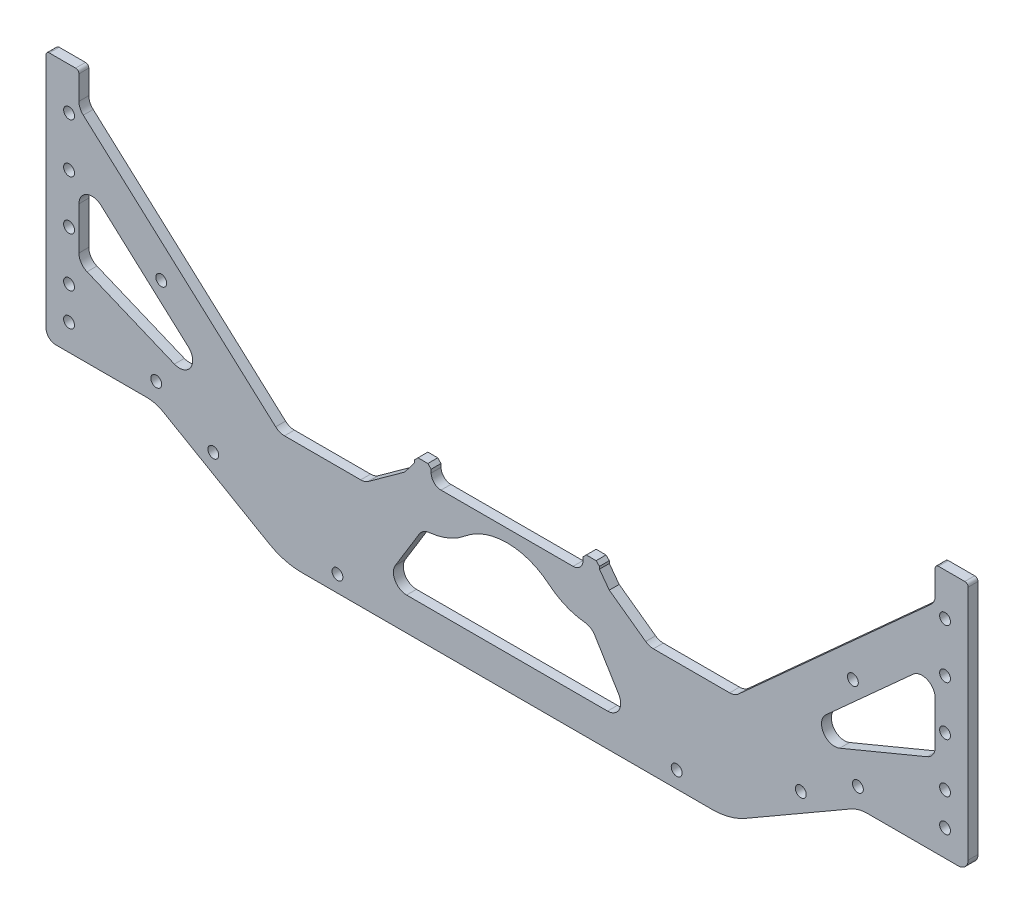
from build123d import *

# Parameters (mm, degrees)
SKETCH_1_R           = 1.65
EXTRUDE_1_DEPTH      = 3
FILLET_1_R           = 20
SKETCH_2_R           = 1.65
CUT_EXTRUDE_1_DEPTH  = 10
EXTRUDE_2_DEPTH      = 3
FILLET_2_R           = 10
EXTRUDE_3_DEPTH      = 3
FILLET_3_R           = 10
FILLET_4_R           = 3
SKETCH_6_R           = 1.65
CUT_EXTRUDE_2_DEPTH  = 5
EXTRUDE_4_DEPTH      = 3
SKETCH_8_R           = 1.65
CUT_EXTRUDE_3_DEPTH  = 10
EXTRUDE_5_DEPTH      = 3
FILLET_5_R           = 3
EXTRUDE_6_DEPTH      = 3
FILLET_6_R           = 2
SKETCH_11_W          = 10
SKETCH_11_H          = 67.386751346
EXTRUDE_7_DEPTH      = 3
SKETCH_14_W          = 280
SKETCH_14_H          = 9.594497852
CUT_EXTRUDE_6_DEPTH  = 30
CUT_EXTRUDE_7_DEPTH  = 10
SKETCH_16_W          = 82.254624056
SKETCH_16_H          = 6
EXTRUDE_8_DEPTH      = 3
CUT_EXTRUDE_9_DEPTH  = 30
FILLET_9_R           = 20
EXTRUDE_10_DEPTH     = 3
CUT_EXTRUDE_10_DEPTH = 10
FILLET_11_R          = 20
CUT_EXTRUDE_11_DEPTH = 10
EXTRUDE_11_DEPTH     = 3
SKETCH_23_W          = 21.095443302
SKETCH_23_H          = 17.701178694
CUT_EXTRUDE_12_DEPTH = 10
SKETCH_24_W          = 16.070083248
SKETCH_24_H          = 4.940251746
SKETCH_24_W_2        = 30.683823142
SKETCH_24_H_2        = 7.471575689
CUT_EXTRUDE_13_DEPTH = 10
EXTRUDE_12_DEPTH     = 3
CHAMFER_1_SIZE       = 10
EXTRUDE_13_DEPTH     = 3
EXTRUDE_14_DEPTH     = 3
FILLET_12_R          = 4
SKETCH_28_R          = 1.65
CUT_EXTRUDE_14_DEPTH = 10
SKETCH_29_W          = 366.05251881
SKETCH_29_H          = 37.988622271
CUT_EXTRUDE_15_DEPTH = 10
FILLET_13_R          = 1
SKETCH_30_W          = 8.246482756
SKETCH_30_H          = 14.254634478
SKETCH_30_W_2        = 7.090703909
SKETCH_30_H_2        = 16.159554859
EXTRUDE_15_DEPTH     = 3
SKETCH_31_R          = 1.65
EXTRUDE_16_DEPTH     = 3
EXTRUDE_17_DEPTH     = 3
FILLET_14_R          = 3
CHAMFER_2_SIZE       = 1


with BuildPart() as part:
    # 草图1 → 凸台-拉伸1 (new body)
    with BuildSketch(Plane.XY):
        Polygon((91.5, 5), (156.5, 42.527767497), (161.5, 33.867513459), (94.179491924, -5), (-41.179491924, -5), (-108.5, 33.867513459), (-103.5, 42.527767497), (-38.5, 5), align=None)
        with Locations((53, 0)):
            Circle(SKETCH_1_R, mode=Mode.SUBTRACT)
        Circle(SKETCH_1_R, mode=Mode.SUBTRACT)
    extrude(amount=EXTRUDE_1_DEPTH)

    # 圆角1
    fillet_1_edges = [part.edges().sort_by_distance(p)[0] for p in [
        (94.179491924, -5, 1.5),
        (-41.179491924, -5, 1.5),
        (-38.5, 5, 1.5),
        (91.5, 5, 1.5),
    ]]
    fillet(fillet_1_edges, radius=FILLET_1_R)

    # 草图2 → 切除-拉伸1 (cut)
    with BuildSketch(Plane.XY.offset(3)):
        with Locations((-62.698729811, 13.197640478)):
            Circle(SKETCH_2_R)
        with Locations((-80.019237886, 23.197640478)):
            Circle(SKETCH_2_R)
        with Locations((133.019237886, 23.197640478)):
            Circle(SKETCH_2_R)
        with Locations((115.698729811, 13.197640478)):
            Circle(SKETCH_2_R)
        with Locations((-25, 0)):
            Circle(SKETCH_2_R)
        with Locations((78, 0)):
            Circle(SKETCH_2_R)
    extrude(amount=-CUT_EXTRUDE_1_DEPTH, mode=Mode.SUBTRACT)

    # 草图3 → 凸台-拉伸2 (add)
    with BuildSketch(Plane.XY.offset(3)):
        with BuildLine():
            Line((-103.5, 42.527767497), (-13.141016151, 5))
            Line((-13.141016151, 5), (-33.141016151, 5))
            ThreePointArc((-33.141016151, 5), (-38.317397053, 5.681483474), (-43.141016151, 7.679491924))
            Line((-43.141016151, 7.679491924), (-103.5, 42.527767497))
        make_face()
        with BuildLine():
            Line((156.5, 42.527767497), (66.141016151, 5))
            Line((66.141016151, 5), (86.141016151, 5))
            ThreePointArc((86.141016151, 5), (91.317397053, 5.681483474), (96.141016151, 7.679491924))
            Line((96.141016151, 7.679491924), (156.5, 42.527767497))
        make_face()
    extrude(amount=-EXTRUDE_2_DEPTH)

    # 圆角2
    fillet_2_edges = [part.edges().sort_by_distance(p)[0] for p in [
        (66.141016151, 5, 1.5),
        (-13.141016151, 5, 1.5),
    ]]
    fillet(fillet_2_edges, radius=FILLET_2_R)

    # 草图4 → 凸台-拉伸3 (add)
    with BuildSketch(Plane.XY.offset(3)):
        Polygon((-103.5, 42.527767497), (-108.5, 33.867513459), (-80.198729811, 17.527767497), (-113.5, 17.527767497), (-113.5, 42.527767497), align=None)
        Polygon((166.5, 17.527767497), (166.5, 42.527767497), (156.5, 42.527767497), (161.5, 33.867513459), (133.198729811, 17.527767497), align=None)
    extrude(amount=-EXTRUDE_3_DEPTH)

    # 圆角3
    fillet_3_edges = [part.edges().sort_by_distance(p)[0] for p in [
        (-80.198729811, 17.527767497, 1.5),
        (133.198729811, 17.527767497, 1.5),
    ]]
    fillet(fillet_3_edges, radius=FILLET_3_R)

    # 圆角4
    fillet_4_edges = [part.edges().sort_by_distance(p)[0] for p in [
        (-113.5, 42.527767497, 1.5),
        (-113.5, 17.527767497, 1.5),
        (166.5, 17.527767497, 1.5),
        (166.5, 42.527767497, 1.5),
    ]]
    fillet(fillet_4_edges, radius=FILLET_4_R)

    # 草图6 → 切除-拉伸2 (cut)
    with BuildSketch(Plane.XY.offset(3)):
        with Locations((-106.5, 35.527767497)):
            Circle(SKETCH_6_R)
        with Locations((-106.5, 25.527767497)):
            Circle(SKETCH_6_R)
        with Locations((159.5, 25.527767497)):
            Circle(SKETCH_6_R)
        with Locations((159.5, 35.527767497)):
            Circle(SKETCH_6_R)
    extrude(amount=-CUT_EXTRUDE_2_DEPTH, mode=Mode.SUBTRACT)

    # 草图7 → 凸台-拉伸4 (add)
    with BuildSketch(Plane.XY.offset(3)):
        Polygon((-40.311555509, 16.284430616), (-13.5, 38.781996955), (26.5, 38.781996955), (66.5, 38.781996955), (93.311555509, 16.284430616), (86.883679412, 8.623986185), (62.860297657, 28.781996955), (26.5, 28.781996955), (-9.860297657, 28.781996955), (-33.883679412, 8.623986185), align=None)
    extrude(amount=-EXTRUDE_4_DEPTH)

    # 草图8 → 切除-拉伸3 (cut)
    with BuildSketch(Plane.XY.offset(3)):
        with Locations((-106.5, 25.527767497)):
            Circle(SKETCH_8_R)
        with Locations((-106.5, 35.527767497)):
            Circle(SKETCH_8_R)
        with Locations((-98.5, 35.527767497)):
            Circle(SKETCH_8_R)
        with Locations((-98.5, 25.527767497)):
            Circle(SKETCH_8_R)
        with Locations((151.5, 25.527767497)):
            Circle(SKETCH_8_R)
        with Locations((151.5, 35.527767497)):
            Circle(SKETCH_8_R)
        with Locations((159.5, 35.527767497)):
            Circle(SKETCH_8_R)
        with Locations((159.5, 25.527767497)):
            Circle(SKETCH_8_R)
    extrude(amount=-CUT_EXTRUDE_3_DEPTH, mode=Mode.SUBTRACT)

    # 草图9 → 凸台-拉伸5 (add)
    with BuildSketch(Plane.XY.offset(3)):
        Polygon((-13.5, 38.781996955), (-111.763518223, 56.108506437), (-113.5, 46.260428907), (-23.5, 30.391000644), align=None)
        Polygon((166.5, 46.260428907), (76.5, 30.391000644), (66.5, 38.781996955), (164.763518223, 56.108506437), align=None)
    extrude(amount=-EXTRUDE_5_DEPTH)

    # 圆角5
    fillet_5_edges = [part.edges().sort_by_distance(p)[0] for p in [
        (82.905079843, 11.962427616, 1.5),
        (-29.905079843, 11.962427616, 1.5),
        (-40.311555509, 16.284430616, 1.5),
        (-13.5, 38.781996955, 1.5),
        (66.5, 38.781996955, 1.5),
        (93.311555509, 16.284430616, 1.5),
        (62.860297657, 28.781996955, 1.5),
        (-9.860297657, 28.781996955, 1.5),
        (-23.5, 30.391000644, 1.5),
        (-113.5, 46.260428907, 1.5),
        (-111.763518223, 56.108506437, 1.5),
        (164.763518223, 56.108506437, 1.5),
        (166.5, 46.260428907, 1.5),
        (76.5, 30.391000644, 1.5),
    ]]
    fillet(fillet_5_edges, radius=FILLET_5_R)

    # 草图10 → 凸台-拉伸6 (add)
    with BuildSketch(Plane.XY.offset(3)):
        Polygon((-108.911388509, 68.918131395), (-113.5, 62.364915041), (-102.142029314, 54.411978348), (-83.5, 51.124885605), align=None)
        Polygon((136.5, 51.124885605), (161.911388509, 68.918131395), (166.5, 62.364915041), (155.142029314, 54.411978348), align=None)
    extrude(amount=-EXTRUDE_6_DEPTH)

    # 圆角6
    fillet_6_edges = [part.edges().sort_by_distance(p)[0] for p in [
        (161.911388509, 68.918131395, 1.5),
        (166.5, 62.364915041, 1.5),
        (155.142029314, 54.411978348, 1.5),
        (136.5, 51.124885605, 1.5),
        (-83.5, 51.124885605, 1.5),
        (-102.142029314, 54.411978348, 1.5),
        (-108.911388509, 68.918131395, 1.5),
        (-113.5, 62.364915041, 1.5),
    ]]
    fillet(fillet_6_edges, radius=FILLET_6_R)

    # 草图11 → 凸台-拉伸7 (add)
    with BuildSketch(Plane.XY.offset(3)):
        with Locations((-108.5, 73.22114317)):
            Rectangle(SKETCH_11_W, SKETCH_11_H)
        with Locations((161.5, 73.22114317)):
            Rectangle(SKETCH_11_W, SKETCH_11_H)
    extrude(amount=-EXTRUDE_7_DEPTH)

    # 草图14 → 切除-拉伸6 (cut)
    with BuildSketch(Plane.XY.offset(3)):
        with Locations((26.5, 102.117269917)):
            Rectangle(SKETCH_14_W, SKETCH_14_H)
    extrude(amount=-CUT_EXTRUDE_6_DEPTH, mode=Mode.SUBTRACT)

    # 草图15 → 切除-拉伸7 (cut)
    with BuildSketch(Plane.XY.offset(3)):
        Polygon((-65.777893081, 48), (-55.052110747, 39), (108.052110747, 39), (118.777893081, 48), align=None)
    extrude(amount=-CUT_EXTRUDE_7_DEPTH, mode=Mode.SUBTRACT)

    # 草图16 → 凸台-拉伸8 (add)
    with BuildSketch(Plane.XY.offset(3)):
        with Locations((26.5, 27.781996955)):
            Rectangle(SKETCH_16_W, SKETCH_16_H)
    extrude(amount=-EXTRUDE_8_DEPTH)

    # 草图17 → 切除-拉伸9 (cut)
    with BuildSketch(Plane.XY.offset(3)):
        with BuildLine():
            Line((43.34483724, 24.781996955), (9.65516276, 24.781996955))
            ThreePointArc((9.65516276, 24.781996955), (26.5, 34), (43.34483724, 24.781996955))
        make_face()
    extrude(amount=-CUT_EXTRUDE_9_DEPTH, mode=Mode.SUBTRACT)

    # 圆角9
    fillet_9_edges = [part.edges().sort_by_distance(p)[0] for p in [
        (9.65516276, 24.781996955, 1.5),
        (43.34483724, 24.781996955, 1.5),
    ]]
    fillet(fillet_9_edges, radius=FILLET_9_R)

    # 草图19 → 凸台-拉伸10 (add)
    with BuildSketch(Plane.XY.offset(3)):
        Polygon((-65.777893081, 48), (-13.758478542, 38.827573696), (-55.052110747, 39), align=None)
        Polygon((118.777893081, 48), (66.758478542, 38.827573696), (108.052110747, 39), align=None)
    extrude(amount=-EXTRUDE_10_DEPTH)

    # 草图20 → 切除-拉伸10 (cut)
    with BuildSketch(Plane.XY.offset(3)):
        Polygon((-13.758478542, 38.827573696), (-8.087196723, 37.827573696), (61.087196723, 37.827573696), (66.758478542, 38.827573696), align=None)
    extrude(amount=-CUT_EXTRUDE_10_DEPTH, mode=Mode.SUBTRACT)

    # 圆角11
    fillet_11_edges = [part.edges().sort_by_distance(p)[0] for p in [
        (-103.5, 65.129036369, 1.5),
        (156.5, 65.129036369, 1.5),
        (61.087196723, 37.827573696, 1.5),
        (-8.087196723, 37.827573696, 1.5),
    ]]
    fillet(fillet_11_edges, radius=FILLET_11_R)

    # 草图21 → 切除-拉伸11 (cut)
    with BuildSketch(Plane.XY.offset(3)):
        Polygon((81.428362829, 26.255613211), (61.222172102, 43.210620398), (156.5, 75.54037738), (156.5, 42.527767497), align=None)
        Polygon((-103.5, 75.54037738), (-103.5, 42.527767497), (-28.428362829, 26.255613211), (-8.222172102, 43.210620398), align=None)
    extrude(amount=-CUT_EXTRUDE_11_DEPTH, mode=Mode.SUBTRACT)

    # 草图22 → 凸台-拉伸11 (add)
    with BuildSketch(Plane.XY.offset(3)):
        Polygon((-103.5, 72.527767497), (-41.994557068, 16.983412483), (-40.35116529, 14.70738517), (-34.595443302, 21.080818261), (-103.5, 83.307167295), align=None)
        Polygon((87.595443302, 21.080818261), (93.35116529, 14.70738517), (94.994557068, 16.983412483), (156.5, 72.527767497), (156.5, 83.307167295), align=None)
    extrude(amount=-EXTRUDE_11_DEPTH)

    # 草图23 → 切除-拉伸12 (cut)
    with BuildSketch(Plane.XY.offset(3)):
        with Locations((-24.047721651, 29.931407608)):
            Rectangle(SKETCH_23_W, SKETCH_23_H)
        with Locations((77.047721651, 29.931407608)):
            Rectangle(SKETCH_23_W, SKETCH_23_H)
    extrude(amount=-CUT_EXTRUDE_12_DEPTH, mode=Mode.SUBTRACT)


with BuildPart() as cut_extrude_12_piece_1:
    # of the separate pieces the step leaves, piece 1, a body of its own (cut_extrude_12_pieces)
    add(part.part.solids().sort_by_distance((-113.5, 20.527767497, 0))[0])



with BuildPart() as cut_extrude_12_piece_2:
    # of the separate pieces the step leaves, piece 2, a body of its own (cut_extrude_12_pieces)
    add(part.part.solids().sort_by_distance((-13.5, 38.781996955, 0))[0])

    # 草图24 → 切除-拉伸13 (cut)
    with BuildSketch(Plane.XY.offset(3)):
        with Locations((-13.257566462, 40.297699569)):
            Rectangle(SKETCH_24_W, SKETCH_24_H)
        with Locations((66.142364697, 41.56336154)):
            Rectangle(SKETCH_24_W_2, SKETCH_24_H_2)
    extrude(amount=-CUT_EXTRUDE_13_DEPTH, mode=Mode.SUBTRACT)


with BuildPart() as cut_extrude_12_piece_1_1:
    add(cut_extrude_12_piece_1.part)

    add(cut_extrude_12_piece_2.part)  # 凸台-拉伸12 merges 切除-拉伸12 piece 2
    # 草图25 → 凸台-拉伸12 (add)
    with BuildSketch(Plane.XY.offset(3)):
        Polygon((-19.038205034, 21.080818261), (-13.5, 37.827573696), (-13.5, 24.781996955), (0.95653384, 24.781996955), (-11.146991254, 5), (-31.045352326, 5), (-31.045352326, 21.080818261), align=None)
        Polygon((84.045352326, 5), (84.045352326, 21.080818261), (72.038205034, 21.080818261), (66.5, 37.827573696), (66.5, 24.781996955), (52.04346616, 24.781996955), (64.146991254, 5), align=None)
    extrude(amount=-EXTRUDE_12_DEPTH)

    # 倒角1
    chamfer_1_edges = [cut_extrude_12_piece_1_1.edges().sort_by_distance(p)[0] for p in [
        (-13.5, 37.827573696, 1.5),
        (66.5, 37.827573696, 1.5),
    ]]
    chamfer(chamfer_1_edges, length=CHAMFER_1_SIZE)

    # 草图26 → 凸台-拉伸13 (add)
    with BuildSketch(Plane.XY.offset(3)):
        Polygon((-16.639794349, 28.333275858), (-19.038205034, 21.080818261), (-34.595443302, 21.080818261), (-42.626243493, 28.333275858), align=None)
        Polygon((69.639794349, 28.333275858), (72.038205034, 21.080818261), (87.595443302, 21.080818261), (95.626243493, 28.333275858), align=None)
    extrude(amount=-EXTRUDE_13_DEPTH)

    # 草图27 → 凸台-拉伸14 (add)
    with BuildSketch(Plane.XY.offset(3)):
        Polygon((-103.5, 72.527767497), (-103.5, 67.138067599), (-53.044419719, 21.572626071), (-41.994557068, 16.983412483), align=None)
        Polygon((94.994557068, 16.983412483), (156.5, 72.527767497), (156.5, 67.138067599), (106.044419719, 21.572626071), align=None)
    extrude(amount=-EXTRUDE_14_DEPTH)

    # 圆角12
    fillet_12_edges = [cut_extrude_12_piece_1_1.edges().sort_by_distance(p)[0] for p in [
        (156.5, 83.307167295, 1.5),
        (0.95653384, 24.781996955, 1.5),
        (166.5, 97.320020991, 1.5),
        (52.04346616, 24.781996955, 1.5),
        (-103.5, 42.527767497, 1.5),
        (156.5, 97.320020991, 1.5),
        (-113.5, 97.320020991, 1.5),
        (-103.5, 97.320020991, 1.5),
        (-103.5, 83.307167295, 1.5),
        (156.5, 42.527767497, 1.5),
        (64.146991254, 5, 1.5),
        (56.5, 37.827573696, 1.5),
        (-3.5, 37.827573696, 1.5),
        (-11.146991254, 5, 1.5),
        (-16.639794349, 28.333275858, 1.5),
        (69.639794349, 28.333275858, 1.5),
        (-42.626243493, 28.333275858, 1.5),
        (95.626243493, 28.333275858, 1.5),
        (-53.044419719, 21.572626071, 1.5),
        (-103.5, 67.138067599, 1.5),
        (106.044419719, 21.572626071, 1.5),
        (156.5, 67.138067599, 1.5),
    ]]
    fillet(fillet_12_edges, radius=FILLET_12_R)

    # 草图28 → 切除-拉伸14 (cut)
    with BuildSketch(Plane.XY.offset(3)):
        with Locations((-106.5, 65.527767497)):
            Circle(SKETCH_28_R)
        with Locations((-106.5, 80.527767497)):
            Circle(SKETCH_28_R)
        with Locations((159.5, 80.527767497)):
            Circle(SKETCH_28_R)
        with Locations((159.5, 65.527767497)):
            Circle(SKETCH_28_R)
        with Locations((-106.5, 50.527767497)):
            Circle(SKETCH_28_R)
        with Locations((159.5, 50.527767497)):
            Circle(SKETCH_28_R)
        with Locations((-78.5, 50.527767497)):
            Circle(SKETCH_28_R)
        with Locations((131.5, 50.527767497)):
            Circle(SKETCH_28_R)
    extrude(amount=-CUT_EXTRUDE_14_DEPTH, mode=Mode.SUBTRACT)

    # 草图29 → 切除-拉伸15 (cut)
    with BuildSketch(Plane.XY.offset(3)):
        with Locations((69.526259405, 112.314332127)):
            Rectangle(SKETCH_29_W, SKETCH_29_H)
    extrude(amount=-CUT_EXTRUDE_15_DEPTH, mode=Mode.SUBTRACT)

    # 圆角13
    fillet_13_edges = [cut_extrude_12_piece_1_1.edges().sort_by_distance(p)[0] for p in [
        (-103.5, 93.320020991, 1.5),
        (-113.5, 93.320020991, 1.5),
        (166.5, 93.320020991, 1.5),
        (156.5, 93.320020991, 1.5),
    ]]
    fillet(fillet_13_edges, radius=FILLET_13_R)

    # 草图30 → 凸台-拉伸15 (add)
    with BuildSketch(Plane.XY.offset(3)):
        with Locations((-98.11802586, 30.163696112)):
            Rectangle(SKETCH_30_W, SKETCH_30_H)
        with Locations((151.615680923, 29.211235922)):
            Rectangle(SKETCH_30_W_2, SKETCH_30_H_2)
    extrude(amount=-EXTRUDE_15_DEPTH)

    # 草图31 → 凸台-拉伸16 (add)
    with BuildSketch(Plane.XY.offset(3)):
        Circle(SKETCH_31_R)
        with Locations((53, 0)):
            Circle(SKETCH_31_R)
    extrude(amount=-EXTRUDE_16_DEPTH)

    # 草图32 → 凸台-拉伸17 (add)
    with BuildSketch(Plane(origin=(0, 0, 0), x_dir=(-1, 0, 0), z_dir=(0, 0, -1))):
        Polygon((-57.548775562, 37.069769785), (-54.548775562, 41.069769785), (-54.548775562, 42.827573696), (-49.548775562, 42.827573696), (-49.548775562, 37.827573696), align=None)
        Polygon((-3.451224438, 42.827573696), (-3.451224438, 37.827573696), (4.548775562, 37.069769785), (1.548775562, 41.069769785), (1.548775562, 42.827573696), align=None)
    extrude(amount=-EXTRUDE_17_DEPTH)

    # 圆角14
    fillet_14_edges = [cut_extrude_12_piece_1_1.edges().sort_by_distance(p)[0] for p in [
        (49.548775562, 37.827573696, 1.5),
        (3.451224438, 37.827573696, 1.5),
    ]]
    fillet(fillet_14_edges, radius=FILLET_14_R)

    # 倒角2
    chamfer_2_edges = [cut_extrude_12_piece_1_1.edges().sort_by_distance(p)[0] for p in [
        (49.548775562, 42.827573696, 1.5),
        (54.548775562, 42.827573696, 1.5),
        (-1.548775562, 42.827573696, 1.5),
        (3.451224438, 42.827573696, 1.5),
    ]]
    chamfer(chamfer_2_edges, length=CHAMFER_2_SIZE)


solid = cut_extrude_12_piece_1_1.part
